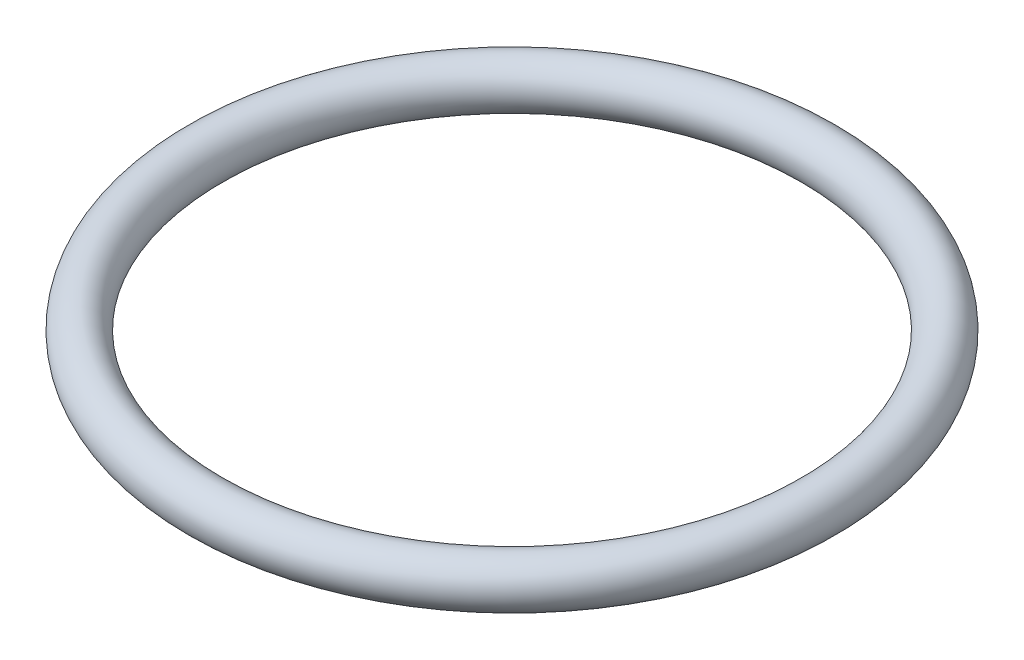
from build123d import *

# Parameters (mm, degrees)
SKETCH4_R = 1.5875


with BuildPart() as part:
    # Sketch4 → Revolve1 (revolve)
    with BuildSketch(Plane.XY):
        with Locations((-20.6375, 0)):
            Circle(SKETCH4_R)
    revolve(axis=Axis((0, 0, 0), (0, 1, 0)))


solid = part.part
